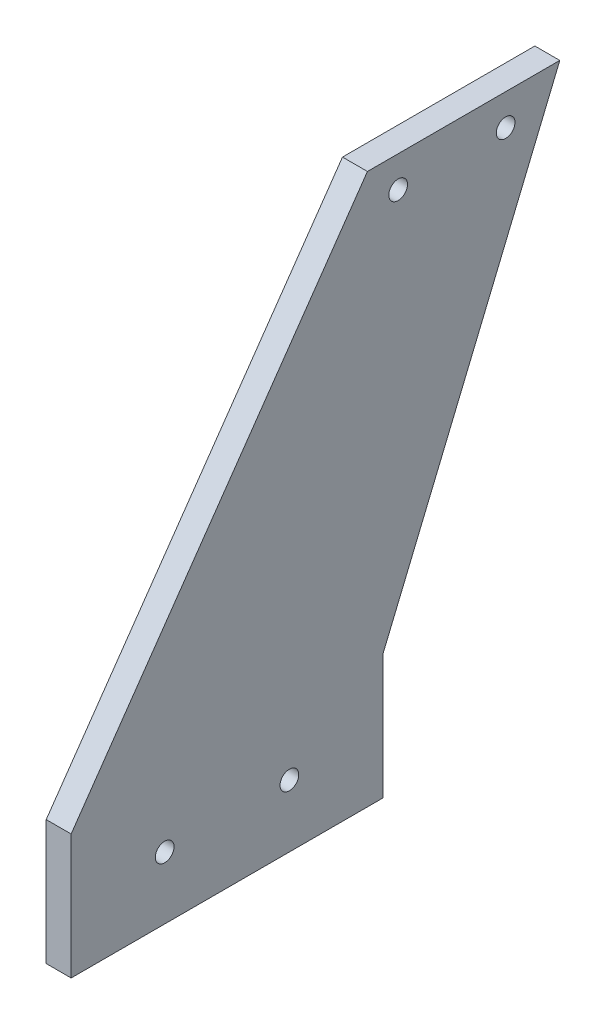
from build123d import *

# Parameters (mm, degrees)
SALIENTE_EXTRUIR1_DEPTH = 4
CROQUIS2_R              = 1.5
CORTAR_EXTRUIR1_DEPTH   = 13
CROQUIS3_R              = 1.5
CORTAR_EXTRUIR2_DEPTH   = 23


with BuildPart() as part:
    # Croquis1 → Saliente-Extruir1 (new body)
    with BuildSketch(Plane(origin=(0, 0, 0), x_dir=(0, 0, -1), z_dir=(1, 0, 0))):
        Polygon((31.77750931, 8.602977891), (79.291659343, 76.856040613), (110.141305144, 76.856040613), (81.77750931, 8.602977891), (81.77750931, -11.397022109), (31.77750931, -11.397022109), align=None)
    extrude(amount=SALIENTE_EXTRUIR1_DEPTH)

    # Croquis2 → Cortar-Extruir1 (cut)
    with BuildSketch(Plane(origin=(4, 0, 0), x_dir=(0, 0, -1), z_dir=(1, 0, 0))):
        with Locations((84.214840877, 71.856040613)):
            Circle(CROQUIS2_R)
        with Locations((101.452703983, 71.856040613)):
            Circle(CROQUIS2_R)
    extrude(amount=-CORTAR_EXTRUIR1_DEPTH, mode=Mode.SUBTRACT)

    # Croquis3 → Cortar-Extruir2 (cut)
    with BuildSketch(Plane.ZY):
        with Locations((-66.77750931, -1.397022109)):
            Circle(CROQUIS3_R)
        with Locations((-46.77750931, -1.397022109)):
            Circle(CROQUIS3_R)
    extrude(amount=-CORTAR_EXTRUIR2_DEPTH, mode=Mode.SUBTRACT)


solid = part.part
